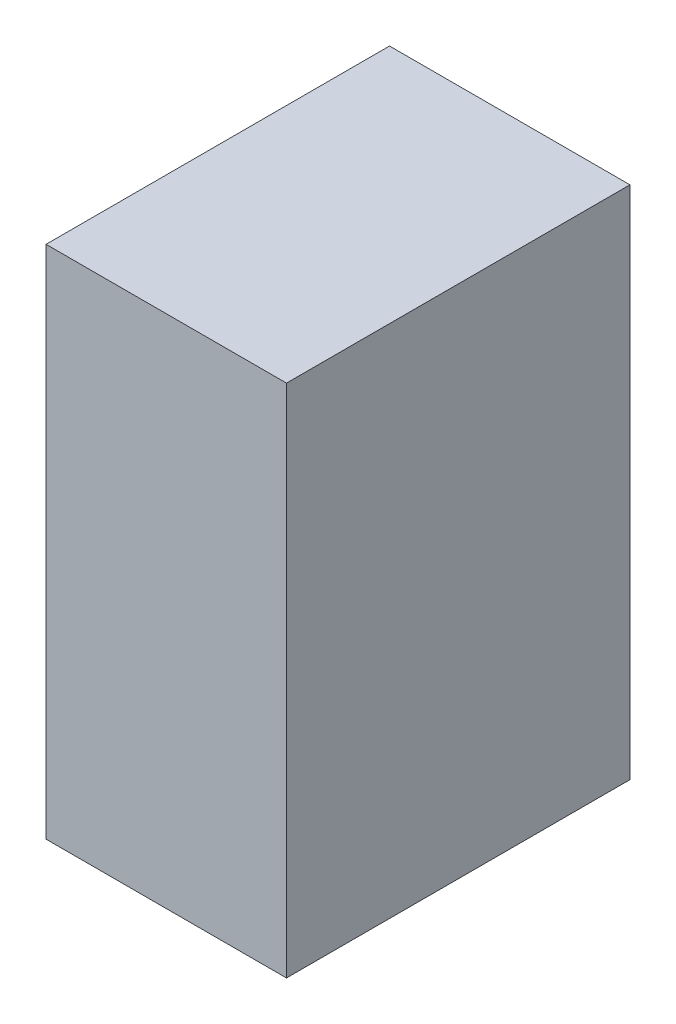
from build123d import *

# Parameters (mm, degrees)
SKETCH1_W           = 35.56
SKETCH1_H           = 50.8
BOSS_EXTRUDE1_DEPTH = 38.1


with BuildPart() as part:
    # Sketch1 → Boss-Extrude1 (new, symmetric)
    with BuildSketch(Plane(origin=(0, 0, 0), x_dir=(1, 0, 0), z_dir=(0, 1, 0))):
        Rectangle(SKETCH1_W, SKETCH1_H)
    extrude(amount=BOSS_EXTRUDE1_DEPTH, both=True)


solid = part.part
